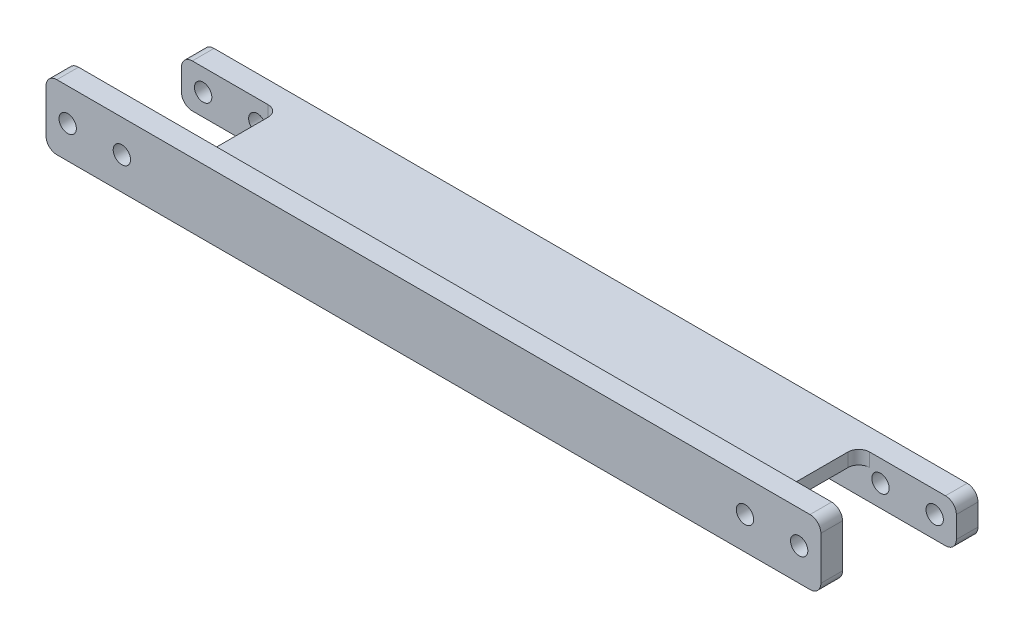
from build123d import *

# Parameters (mm, degrees)
SKETCH_1_W      = 143
SKETCH_1_H      = 8
SKETCH_1_R      = 1.6
EXTRUDE_1_DEPTH = 4
SKETCH_2_W      = 107
SKETCH_2_H      = 2.5
EXTRUDE_2_DEPTH = 21
SKETCH_3_W      = 143
SKETCH_3_H      = 12
SKETCH_3_R      = 1.6
EXTRUDE_4_DEPTH = 4
FILLET_1_R      = 2


with BuildPart() as part:
    # 草图1 → 凸台-拉伸1 (new body)
    with BuildSketch(Plane.XY):
        Rectangle(SKETCH_1_W, SKETCH_1_H)
        with Locations((-67.5, 0)):
            Circle(SKETCH_1_R, mode=Mode.SUBTRACT)
        with Locations((-57.5, 0)):
            Circle(SKETCH_1_R, mode=Mode.SUBTRACT)
        with Locations((57.5, 0)):
            Circle(SKETCH_1_R, mode=Mode.SUBTRACT)
        with Locations((67.5, 0)):
            Circle(SKETCH_1_R, mode=Mode.SUBTRACT)
    extrude(amount=EXTRUDE_1_DEPTH)

    # 草图2 → 凸台-拉伸2 (add)
    with BuildSketch(Plane.XY.offset(4)):
        with Locations((0, 2.75)):
            Rectangle(SKETCH_2_W, SKETCH_2_H)
    extrude(amount=EXTRUDE_2_DEPTH)

    # 草图3 → 凸台-拉伸4 (add)
    with BuildSketch(Plane.XY.offset(25)):
        with Locations((0, 7.5)):
            Rectangle(SKETCH_3_W, SKETCH_3_H)
        with Locations((67.5, 7.5)):
            Circle(SKETCH_3_R, mode=Mode.SUBTRACT)
        with Locations((57.5, 7.5)):
            Circle(SKETCH_3_R, mode=Mode.SUBTRACT)
        with Locations((-67.5, 7.5)):
            Circle(SKETCH_3_R, mode=Mode.SUBTRACT)
        with Locations((-57.5, 7.5)):
            Circle(SKETCH_3_R, mode=Mode.SUBTRACT)
    extrude(amount=EXTRUDE_4_DEPTH)

    # 圆角1
    fillet_1_edges = [part.edges().sort_by_distance(p)[0] for p in [
        (53.5, 2.75, 25),
        (-53.5, 2.75, 4),
        (-53.5, 2.75, 25),
        (53.5, 2.75, 4),
        (-71.5, 13.5, 27),
        (-71.5, 1.5, 27),
        (71.5, 1.5, 27),
        (71.5, 13.5, 27),
        (71.5, -4, 2),
        (-71.5, -4, 2),
        (-71.5, 4, 2),
        (71.5, 4, 2),
    ]]
    fillet(fillet_1_edges, radius=FILLET_1_R)


solid = part.part
